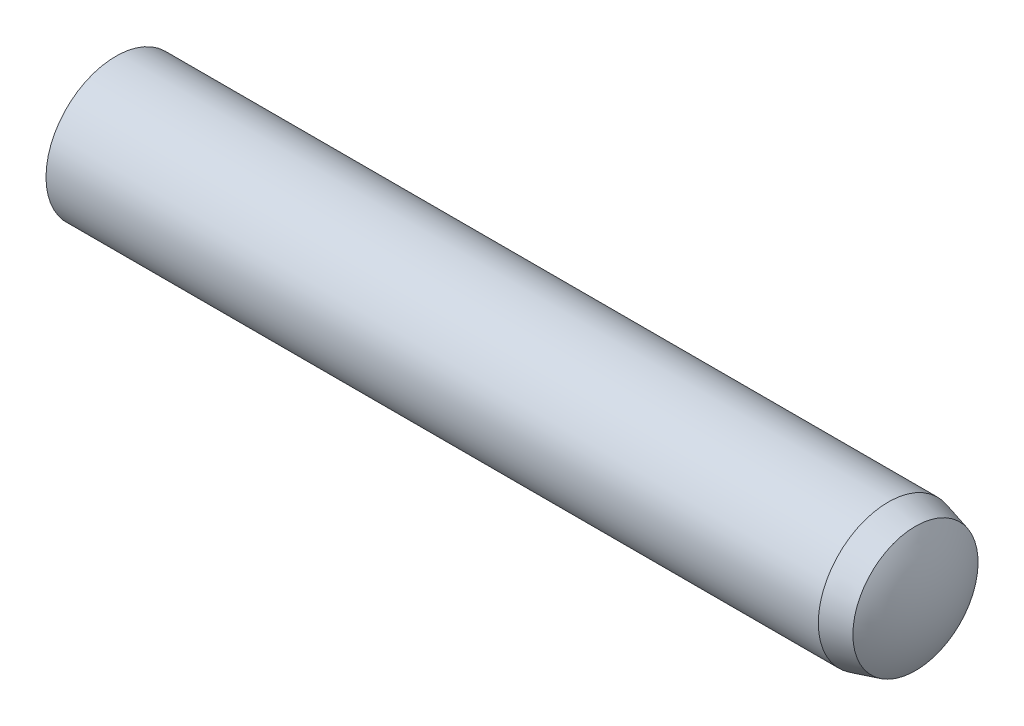
from build123d import *

# Parameters (mm, degrees)
EXTRUDE1_DEPTH      = 6
EXTRUDE1_DEPTH_BACK = 6
SKETCH2_R           = 1


with BuildPart() as part:
    # Sketch2 → Extrude1 (new, two sides: drawn at the far end of the back side and taken through both)
    with BuildSketch(Plane(origin=(0, 0, 0), x_dir=(0, 0, -1), z_dir=(1, 0, 0)).offset(-EXTRUDE1_DEPTH_BACK)):
        Circle(SKETCH2_R)
    extrude(amount=EXTRUDE1_DEPTH + EXTRUDE1_DEPTH_BACK)

    # Sketch5 → Cut-Revolve1 (revolve, cut)
    with BuildSketch(Plane.XY, mode=Mode.PRIVATE) as cut_revolve1_sk:
        with BuildLine():
            Line((5.35, 1), (5.35, 1.5))
            Line((5.35, 1.5), (6.5, 1.5))
            Line((6.5, 1.5), (6.5, 0))
            Line((6.5, 0), (6, 0))
            ThreePointArc((6, 0), (5.933685026, 0.46624026), (5.74, 0.895499815))
            Line((5.74, 0.895499815), (5.35, 1))
        make_face()
        with BuildLine():
            Line((-5.7, 1), (-5.7, 1.5))
            Line((-5.7, 1.5), (-6.5, 1.5))
            Line((-6.5, 1.5), (-6.5, 0))
            Line((-6.5, 0), (-6, 0))
            ThreePointArc((-6, 0), (-5.923384418, 0.522015325), (-5.7, 1))
        make_face()
    revolve(cut_revolve1_sk.sketch.rotate(Axis((-6, 0, 0), (1, 0, 0)), 90), axis=Axis((-6, 0, 0), (1, 0, 0)), mode=Mode.SUBTRACT)


solid = part.part
